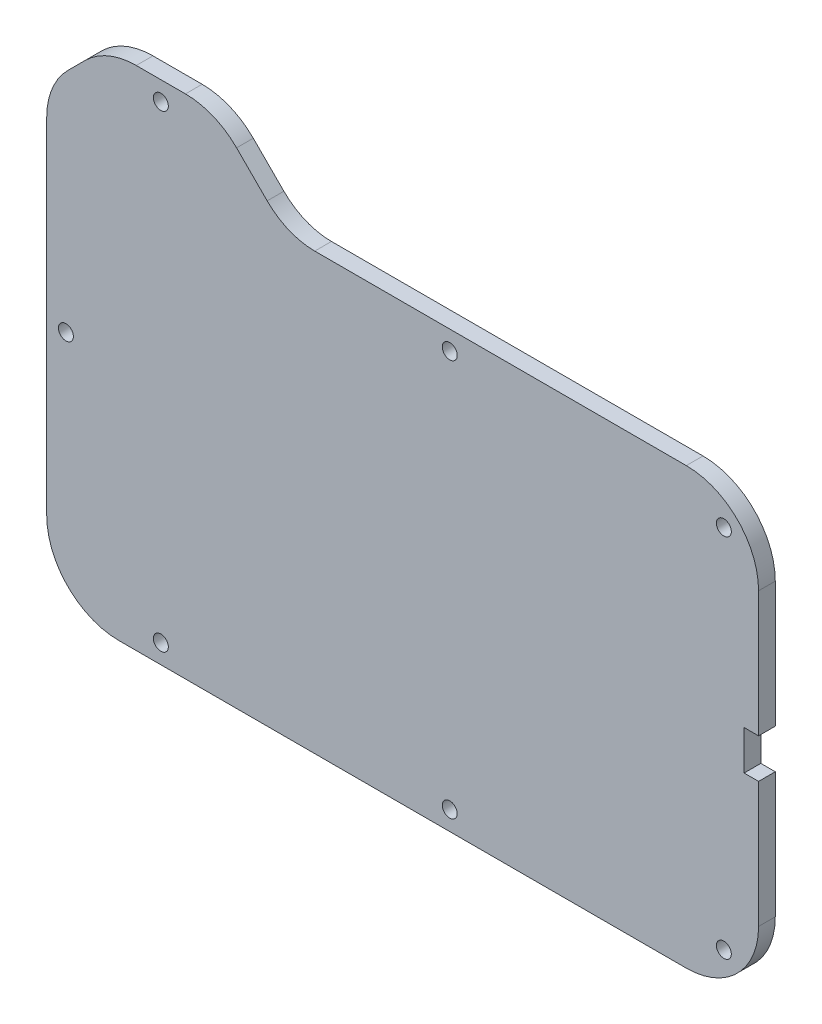
from build123d import *

# Parameters (mm, degrees)
SKETCH1_R           = 1.425
BOSS_EXTRUDE1_DEPTH = 3.175


with BuildPart() as part:
    # Sketch1 → Boss-Extrude1 (new body)
    with BuildSketch(Plane.XY):
        with BuildLine():
            Line((143.808069079, 20.460501739), (143.808069079, 44.360501739))
            Line((143.808069079, 44.360501739), (141.058069079, 44.360501739))
            Line((141.058069079, 44.360501739), (141.058069079, 51.860501739))
            Line((141.058069079, 51.860501739), (143.808069079, 51.860501739))
            Line((143.808069079, 51.860501739), (143.808069079, 75.76050174))
            ThreePointArc((143.808069079, 75.76050174), (139.780787321, 85.483219981), (130.058069079, 89.51050174))
            Line((130.058069079, 89.51050174), (59.375183039, 89.51050174))
            ThreePointArc((59.375183039, 89.51050174), (54.476835105, 90.484843724), (50.32421624, 93.259534941))
            Line((50.32421624, 93.259534941), (44.500531199, 99.083219981))
            ThreePointArc((44.500531199, 99.083219981), (40.039710153, 102.063845312), (34.777812958, 103.11050174))
            Line((34.777812958, 103.11050174), (25.414810921, 103.11050174))
            ThreePointArc((25.414810921, 103.11050174), (20.152913726, 102.063845312), (15.69209268, 99.083219981))
            Line((15.69209268, 99.083219981), (12.411836559, 95.80296386))
            ThreePointArc((12.411836559, 95.80296386), (9.431211228, 91.342142814), (8.3845548, 86.080245619))
            Line((8.3845548, 86.080245619), (8.3845548, 20.460501739))
            ThreePointArc((8.3845548, 20.460501739), (12.411836559, 10.737783497), (22.1345548, 6.710501739))
            Line((22.1345548, 6.710501739), (130.058069079, 6.710501739))
            ThreePointArc((130.058069079, 6.710501739), (139.780787321, 10.737783497), (143.808069079, 20.460501739))
        make_face()
        with Locations((12.0345548, 52.470373679)):
            Circle(SKETCH1_R, mode=Mode.SUBTRACT)
        with Locations((30.09631194, 99.46050174)):
            Circle(SKETCH1_R, mode=Mode.SUBTRACT)
        with Locations((85.053742799, 85.86050174)):
            Circle(SKETCH1_R, mode=Mode.SUBTRACT)
        with Locations((137.199847569, 82.902280229)):
            Circle(SKETCH1_R, mode=Mode.SUBTRACT)
        with Locations((137.199847569, 13.318723249)):
            Circle(SKETCH1_R, mode=Mode.SUBTRACT)
        with Locations((85.053742799, 10.36050174)):
            Circle(SKETCH1_R, mode=Mode.SUBTRACT)
        with Locations((30.09631194, 10.36050174)):
            Circle(SKETCH1_R, mode=Mode.SUBTRACT)
    extrude(amount=BOSS_EXTRUDE1_DEPTH)


solid = part.part
